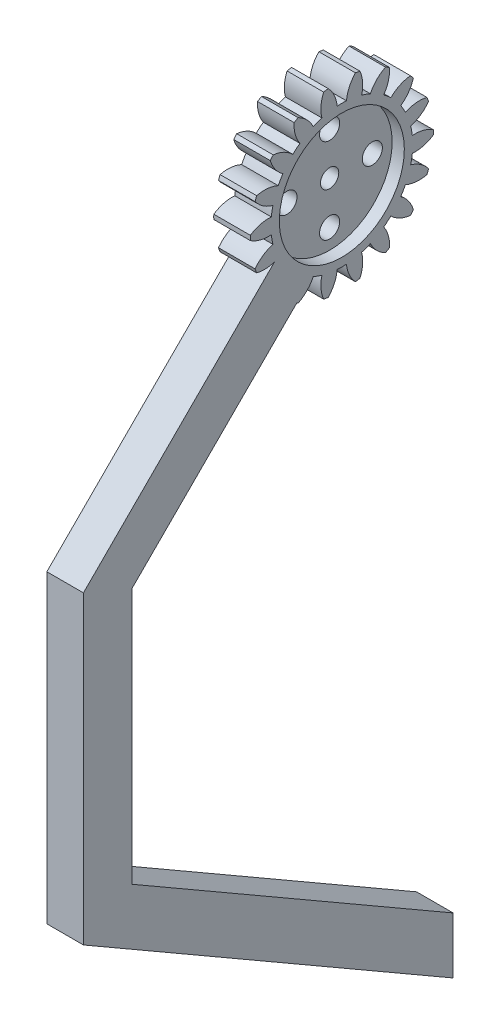
from build123d import *

# Parameters (mm, degrees)
BASPROSKE_W         = 6
BASPROSKE_H         = 15
TOOTHCUT_DEPTH      = 23.045407685
TEETHCUTS_COUNT     = 18
TEETHCUTS_ANGLE     = 340
BORSKE_R            = 1.5
BORE_DEPTH          = 50.0000508
EXTRUDE_2_DEPTH     = 6
SKETCH_2_R          = 1.65
CUT_EXTRUDE_1_DEPTH = 6
SKETCH_3_R          = 10.25
CUT_EXTRUDE_2_DEPTH = 2


with BuildPart() as part:
    # BasProSke → Base-Revolve (revolve)
    with BuildSketch(Plane(origin=(0, 0, 0), x_dir=(1, 0, 0), z_dir=(0, 1, 0))):
        with Locations((3, 7.5)):
            Rectangle(BASPROSKE_W, BASPROSKE_H)
    revolve(axis=Axis((-10, 0, 0), (1, 0, 0)))

    # TooCutSke → ToothCut (cut, through all)
    with BuildSketch(Plane(origin=(0, 0, 0), x_dir=(0, 0, -1), z_dir=(1, 0, 0))):
        with BuildLine():
            ThreePointArc((0.759974923, 11.599129886), (0, 11.624), (-0.759974923, 11.599129886))
            ThreePointArc((-0.759974923, 11.599129886), (-1.229186471, 13.354767823), (-2.254227748, 14.855339189))
            ThreePointArc((-2.254227748, 14.855339189), (0, 15.0254), (2.254227748, 14.855339189))
            ThreePointArc((2.254227748, 14.855339189), (1.229186471, 13.354767823), (0.759974923, 11.599129886))
        make_face()
    toothcut = extrude(amount=TOOTHCUT_DEPTH, mode=Mode.SUBTRACT)

    # TeethCuts: ToothCut ×18 about axis
    teethcuts_axis = Axis((-10, 0, 0), (1, 0, 0))
    for i in range(1, TEETHCUTS_COUNT):
        add(toothcut.rotate(teethcuts_axis, i * TEETHCUTS_ANGLE / (TEETHCUTS_COUNT - 1)), mode=Mode.SUBTRACT)

    # BorSke → Bore (cut, symmetric)
    with BuildSketch(Plane(origin=(0, 0, 0), x_dir=(0, 0, -1), z_dir=(1, 0, 0))):
        Circle(BORSKE_R)
    extrude(amount=BORE_DEPTH, both=True, mode=Mode.SUBTRACT)

    # 草图1 → 凸台-拉伸2 (add)
    with BuildSketch(Plane(origin=(6, 0, 0), x_dir=(0, 0, -1), z_dir=(1, 0, 0))):
        Polygon((-10.545854675, -4.889000426), (-42.365659829, -36.708805579), (-42.365659829, -86.708805579), (18.256118436, -121.708805579), (18.256118436, -112.471201272), (-34.365659829, -82.090003426), (-34.365659829, -40.022514078), (-4.889000426, -10.545854675), align=None)
    extrude(amount=-EXTRUDE_2_DEPTH)

    # 草图2 → 切除-拉伸1 (cut)
    with BuildSketch(Plane(origin=(6, 0, 0), x_dir=(0, 0, -1), z_dir=(1, 0, 0))):
        with Locations((-7, 0)):
            Circle(SKETCH_2_R)
        with Locations((0, 7)):
            Circle(SKETCH_2_R)
        with Locations((7, 0)):
            Circle(SKETCH_2_R)
        with Locations((0, -7)):
            Circle(SKETCH_2_R)
    extrude(amount=-CUT_EXTRUDE_1_DEPTH, mode=Mode.SUBTRACT)

    # 草图3 → 切除-拉伸2 (cut)
    with BuildSketch(Plane(origin=(6, 0, 0), x_dir=(0, 0, -1), z_dir=(1, 0, 0))):
        Circle(SKETCH_3_R)
    extrude(amount=-CUT_EXTRUDE_2_DEPTH, mode=Mode.SUBTRACT)


solid = part.part
